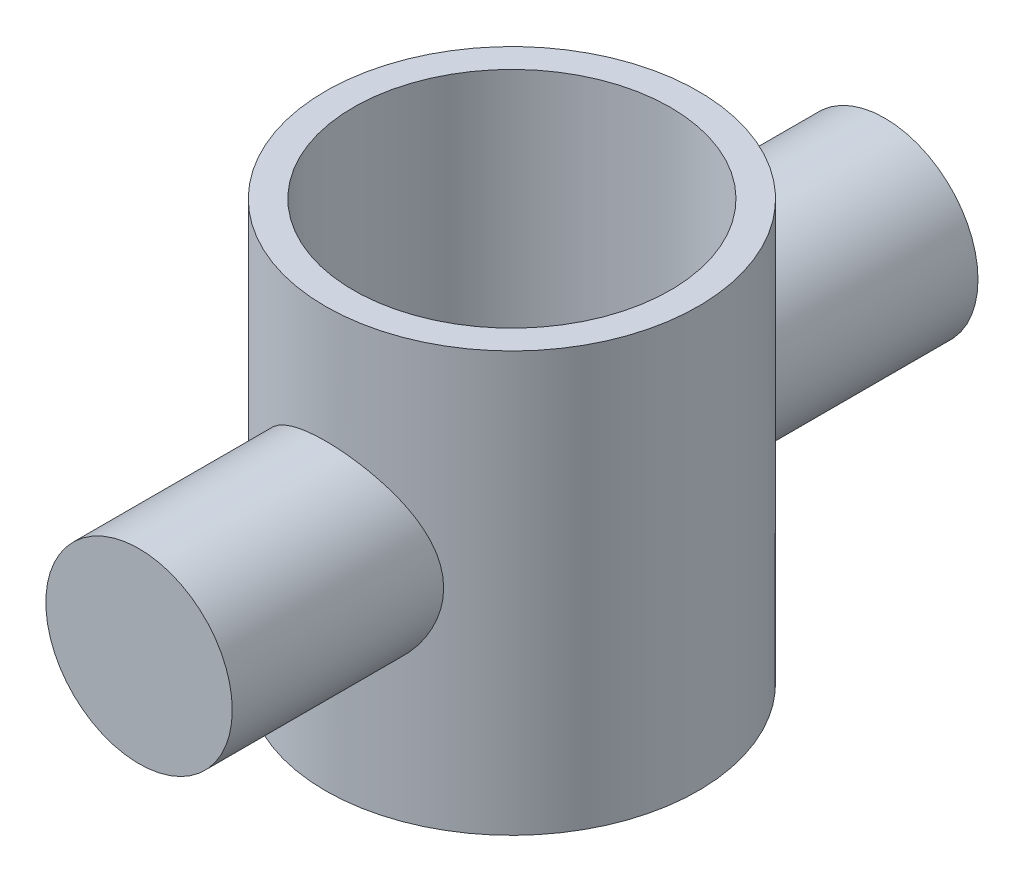
from build123d import *

# Parameters (mm, degrees)
SKETCH_2_R           = 20
SKETCH_2_R_2         = 17
EXTRUDE_1_DEPTH      = 45
EXTRUDE_2_REACH      = 79.621
EXTRUDE_2_END_RADIUS = 20
SKETCH_3_R           = 10


with BuildPart() as part:
    # 草图2 → 凸台-拉伸1 (new body)
    with BuildSketch(Plane(origin=(0, 0, 0), x_dir=(1, 0, 0), z_dir=(0, 1, 0))):
        with Locations(Location((0, 0, 0), (0, 0, 90))):
            Circle(SKETCH_2_R)
        with Locations(Location((0, 0, 0), (0, 0, 90))):
            Circle(SKETCH_2_R_2, mode=Mode.SUBTRACT)
    extrude(amount=EXTRUDE_1_DEPTH)

    # 凸台-拉伸2: up to this cylinder (the profile starts outside it)
    extrude_2_end = Plane(origin=(0, 22.5, 0), z_dir=(0, -1, 0)) * Cylinder(EXTRUDE_2_END_RADIUS, 200.242, mode=Mode.PRIVATE)
    # 草图3 → 凸台-拉伸2 (add, up to the surface)
    with BuildSketch(Plane.XY.offset(40), mode=Mode.PRIVATE) as extrude_2_sk1:
        with Locations((0, 22.5)):
            Circle(SKETCH_3_R)
    extrude_2_tool1 = extrude(extrude_2_sk1.sketch, amount=-EXTRUDE_2_REACH, mode=Mode.PRIVATE) - extrude_2_end
    extrude_2 = extrude_2_tool1.solids().sort_by_distance((0, 22.5, 40))[0]
    add(extrude_2)

    # 镜向2: 凸台-拉伸2 across plane
    add(extrude_2.mirror(Plane.XY))


solid = part.part
